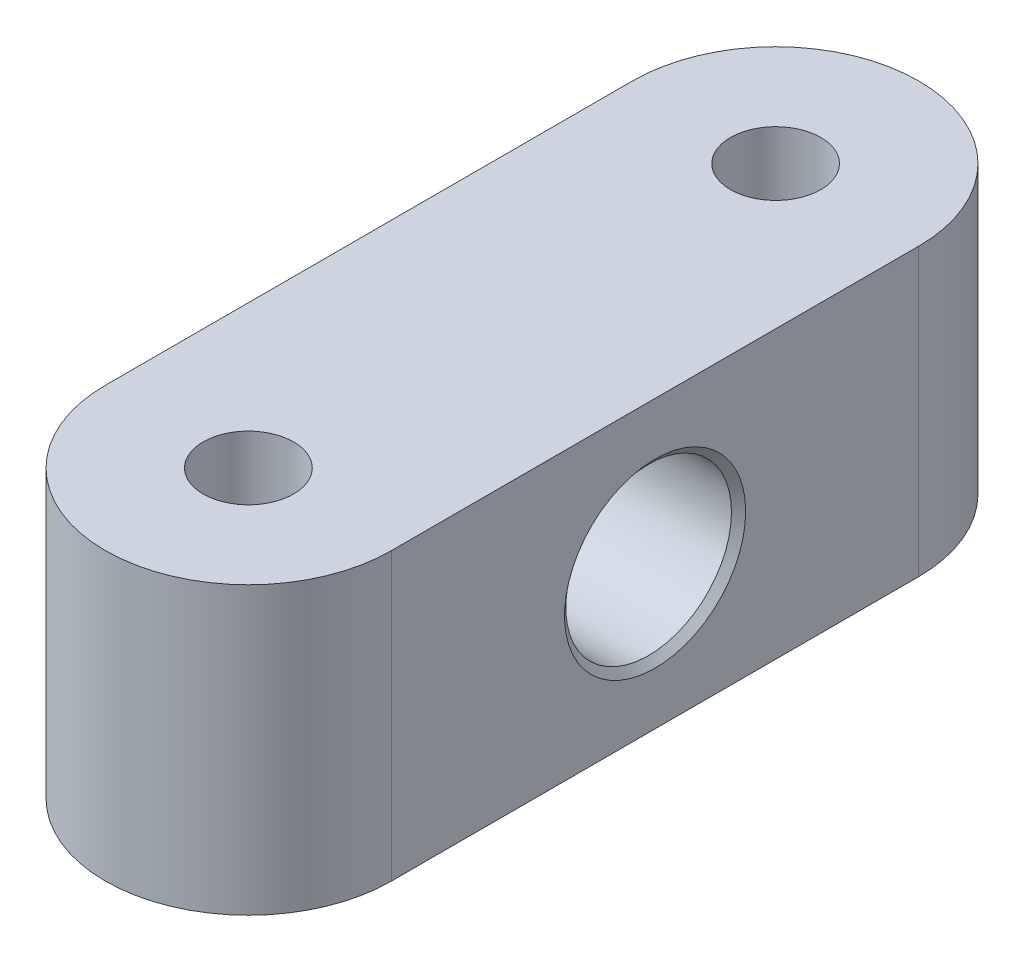
from build123d import *

# Parameters (mm, degrees)
SKETCH1_R                        = 6
BOSS_EXTRUDE1_DEPTH              = 19
M24X2_0_TAPPED_HOLE1_D           = 22
M24X2_0_TAPPED_HOLE1_DEPTH       = 38
M24X2_0_TAPPED_HOLE1_CSINK_D     = 24.05
M24X2_0_TAPPED_HOLE1_CSINK_ANGLE = 100
M24X2_0_TAPPED_HOLE1_TIP         = 6.609466809


with BuildPart() as part:
    # Sketch1 → Boss-Extrude1 (new, symmetric)
    with BuildSketch(Plane(origin=(0, 0, 0), x_dir=(1, 0, 0), z_dir=(0, 1, 0))):
        with BuildLine():
            Line((-19, 0), (-19, 70))
            ThreePointArc((-19, 70), (0, 89), (19, 70))
            Line((19, 70), (19, 0))
            ThreePointArc((19, 0), (0, -19), (-19, 0))
        make_face()
        with Locations(Location((0, 70, 0), (0, 0, 270))):
            Circle(SKETCH1_R, mode=Mode.SUBTRACT)
        with Locations(Location((0, 0, 0), (0, 0, 270))):
            Circle(SKETCH1_R, mode=Mode.SUBTRACT)
    extrude(amount=BOSS_EXTRUDE1_DEPTH, both=True)

    # M24x2.0 Tapped Hole1
    with Locations(Plane(origin=(19, 0, 0), x_dir=(0, 0, -1), z_dir=(1, 0, 0))):
        with Locations((35, 0)):
            CounterSinkHole(M24X2_0_TAPPED_HOLE1_D / 2, M24X2_0_TAPPED_HOLE1_CSINK_D / 2, depth=M24X2_0_TAPPED_HOLE1_DEPTH, counter_sink_angle=M24X2_0_TAPPED_HOLE1_CSINK_ANGLE)
            with Locations((0, 0, -(M24X2_0_TAPPED_HOLE1_DEPTH + M24X2_0_TAPPED_HOLE1_TIP / 2))):  # 118° drill point
                Cone(0, M24X2_0_TAPPED_HOLE1_D / 2, M24X2_0_TAPPED_HOLE1_TIP, mode=Mode.SUBTRACT)


solid = part.part
